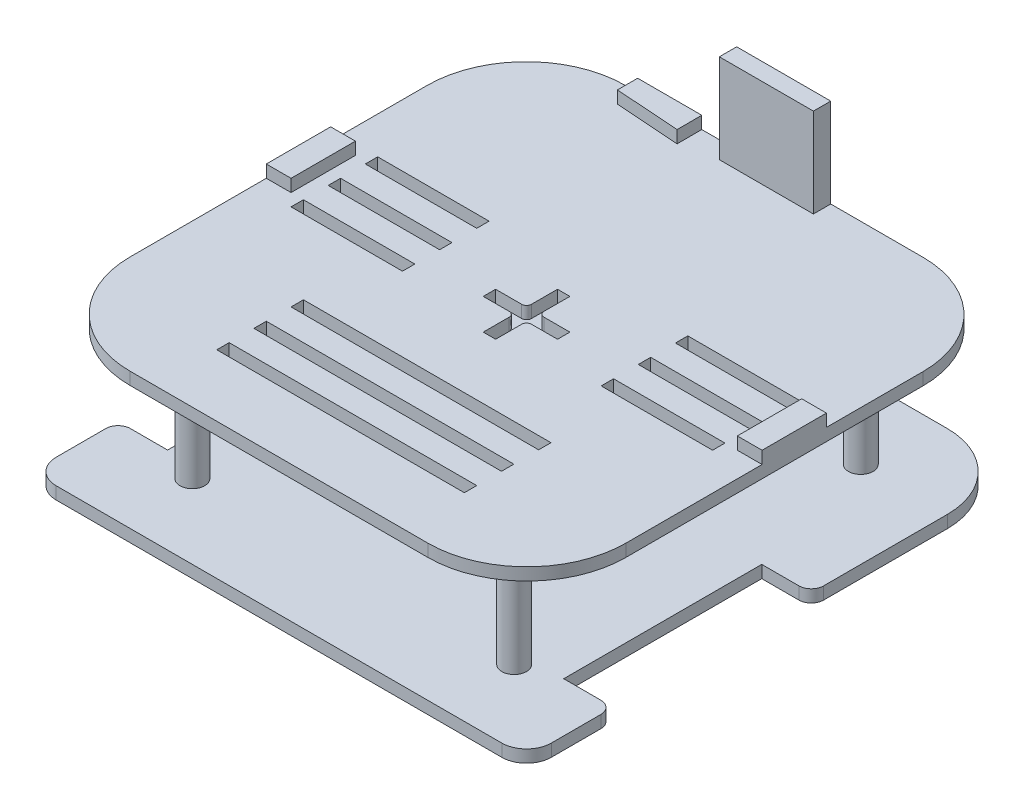
from build123d import *

# Parameters (mm, degrees)
SKETCH1_W                = 200
SKETCH1_H                = 200
BOSS_EXTRUDE1_DEPTH      = 5
FILLET1_R                = 10
FILLET3_R                = 30
SKETCH5_W                = 20
SKETCH5_H                = 80
CUT_EXTRUDE2_DEPTH       = 142.509716981
BOSS_EXTRUDE3_DEPTH      = 100
BOSS_EXTRUDE3_DEPTH_BACK = 100
SKETCH8_W                = 240
SKETCH8_H                = 5
SKETCH9_R                = 5
BOSS_EXTRUDE4_DEPTH      = 58
MIRROR6_COPY_1_SKETCH_R  = 5
MIRROR6_COPY_1_DEPTH     = 58
FILLET4_R                = 5
SKETCH11_W               = 12.5
SKETCH11_H               = 5
SKETCH11_W_2             = 5
SKETCH11_H_2             = 12.5
CUT_EXTRUDE4_DEPTH       = 5
FILLET6_R                = 2
SKETCH15_W               = 100
SKETCH15_H               = 5
SKETCH15_W_2             = 45
CUT_EXTRUDE6_DEPTH       = 5
SKETCH18_W               = 20
SKETCH18_H               = 200
CUT_EXTRUDE7_DEPTH       = 5
FILLET7_R                = 40
SKETCH22_W               = 6
SKETCH22_H               = 17
CUT_EXTRUDE10_DEPTH      = 5
SKETCH26_W               = 10
SKETCH26_H               = 26
BOSS_EXTRUDE6_DEPTH      = 5
SKETCH27_W               = 38
SKETCH27_H               = 7
BOSS_EXTRUDE7_DEPTH      = 36


with BuildPart() as part:
    # Sketch1 → Boss-Extrude1 (new body)
    with BuildSketch(Plane(origin=(0, 0, 0), x_dir=(1, 0, 0), z_dir=(0, 1, 0))):
        Rectangle(SKETCH1_W, SKETCH1_H)
    extrude(amount=BOSS_EXTRUDE1_DEPTH)

    # Fillet1
    fillet1_edges = [part.edges().sort_by_distance(p)[0] for p in [
        (100, 2.5, 100),
        (-100, 2.5, 100),
    ]]
    fillet(fillet1_edges, radius=FILLET1_R)

    # Fillet3
    fillet3_edges = [part.edges().sort_by_distance(p)[0] for p in [
        (-100, 2.5, -100),
        (100, 2.5, -100),
    ]]
    fillet(fillet3_edges, radius=FILLET3_R)

    # Sketch5 → Cut-Extrude2 (cut, through all)
    with BuildSketch(Plane(origin=(0, 5, 0), x_dir=(1, 0, 0), z_dir=(0, 1, 0))):
        with Locations((90, -25)):
            Rectangle(SKETCH5_W, SKETCH5_H)
    cut_extrude2 = extrude(amount=-CUT_EXTRUDE2_DEPTH, mode=Mode.SUBTRACT)

    # Mirror1: Cut-Extrude2 across plane
    add(cut_extrude2.mirror(Plane(origin=(0, 0, 0), x_dir=(0, 0, 1), z_dir=(1, 0, 0))), mode=Mode.SUBTRACT)

    # Sketch9 → Boss-Extrude4 (add)
    with BuildSketch(Plane(origin=(0, 0, 0), x_dir=(1, 0, 0), z_dir=(0, 1, 0))):
        with Locations(Location((-65, -70, 0), (0, 0, 90))):
            Circle(SKETCH9_R)
    boss_extrude4 = extrude(amount=BOSS_EXTRUDE4_DEPTH)

    # Mirror5: Boss-Extrude4 across plane
    add(boss_extrude4.mirror(Plane(origin=(0, 0, 0), x_dir=(0, 0, 1), z_dir=(1, 0, 0))))

    # Mirror6: Boss-Extrude4 across plane
    add(boss_extrude4.mirror(Plane.XY))

    # Mirror6 copy 1 sketch → Mirror6 copy 1 (add)
    with BuildSketch(Plane(origin=(0, 0, 0), x_dir=(-1, 0, 0), z_dir=(0, 1, 0))):
        with Locations(Location((-65, -70, 0), (0, 0, 90))):
            Circle(MIRROR6_COPY_1_SKETCH_R)
    extrude(amount=MIRROR6_COPY_1_DEPTH)

    # Fillet4
    fillet4_edges = [part.edges().sort_by_distance(p)[0] for p in [
        (100, 2.5, -15),
        (100, 2.5, 65),
        (-100, 2.5, 65),
        (-100, 2.5, -15),
    ]]
    fillet(fillet4_edges, radius=FILLET4_R)

    # Sketch22 → Cut-Extrude10 (cut)
    with BuildSketch(Plane(origin=(0, 5, 0), x_dir=(1, 0, 0), z_dir=(0, 1, 0))):
        with Locations((19.2, -24.5)):
            Rectangle(SKETCH22_W, SKETCH22_H)
    cut_extrude10 = extrude(amount=-CUT_EXTRUDE10_DEPTH, mode=Mode.SUBTRACT)

    # Mirror8: Cut-Extrude10 across plane
    add(cut_extrude10.mirror(Plane(origin=(0, 0, 0), x_dir=(0, 0, 1), z_dir=(1, 0, 0))), mode=Mode.SUBTRACT)


with BuildPart() as body_2:
    # Sketch8 → Boss-Extrude3 (new, two sides: drawn at the far end of the back side and taken through both)
    with BuildSketch(Plane.XY.offset(-BOSS_EXTRUDE3_DEPTH_BACK)):
        with Locations((-0.132111847, 57.5)):
            Rectangle(SKETCH8_W, SKETCH8_H)
    extrude(amount=BOSS_EXTRUDE3_DEPTH + BOSS_EXTRUDE3_DEPTH_BACK)

    # Sketch11 → Cut-Extrude4 (cut)
    with BuildSketch(Plane(origin=(0, 60, 0), x_dir=(1, 0, 0), z_dir=(0, 1, 0))):
        with Locations((8.75, 0)):
            Rectangle(SKETCH11_W, SKETCH11_H)
        with Locations((0, -8.75)):
            Rectangle(SKETCH11_W_2, SKETCH11_H_2)
        with Locations((-8.75, 0)):
            Rectangle(SKETCH11_W, SKETCH11_H)
        with Locations((0, 8.75)):
            Rectangle(SKETCH11_W_2, SKETCH11_H_2)
        Rectangle(SKETCH11_W_2, SKETCH11_H)
    extrude(amount=-CUT_EXTRUDE4_DEPTH, mode=Mode.SUBTRACT)

    # Fillet6
    fillet6_edges = [body_2.edges().sort_by_distance(p)[0] for p in [
        (2.5, 57.5, 2.5),
        (-2.5, 57.5, 2.5),
        (-2.5, 57.5, -2.5),
        (2.5, 57.5, -2.5),
    ]]
    fillet(fillet6_edges, radius=FILLET6_R)

    # Sketch15 → Cut-Extrude6 (cut)
    with BuildSketch(Plane(origin=(0, 60, 0), x_dir=(1, 0, 0), z_dir=(0, 1, 0))):
        with Locations((-0.132111847, -42.5)):
            Rectangle(SKETCH15_W, SKETCH15_H)
        with Locations((-0.132111847, -57.5)):
            Rectangle(SKETCH15_W, SKETCH15_H)
        with Locations((-0.132111847, -72.5)):
            Rectangle(SKETCH15_W, SKETCH15_H)
        with Locations((-62.632111847, -7.5)):
            Rectangle(SKETCH15_W_2, SKETCH15_H)
        with Locations((-62.632111847, 7.5)):
            Rectangle(SKETCH15_W_2, SKETCH15_H)
        with Locations((-62.632111847, 22.5)):
            Rectangle(SKETCH15_W_2, SKETCH15_H)
        with Locations((62.632111847, -7.5)):
            Rectangle(SKETCH15_W_2, SKETCH15_H)
        with Locations((62.632111847, 7.5)):
            Rectangle(SKETCH15_W_2, SKETCH15_H)
        with Locations((62.632111847, 22.5)):
            Rectangle(SKETCH15_W_2, SKETCH15_H)
    extrude(amount=-CUT_EXTRUDE6_DEPTH, mode=Mode.SUBTRACT)

    # Sketch18 → Cut-Extrude7 (cut)
    with BuildSketch(Plane(origin=(0, 60, 0), x_dir=(1, 0, 0), z_dir=(0, 1, 0))):
        with Locations((-110.132111847, 0)):
            Rectangle(SKETCH18_W, SKETCH18_H)
    cut_extrude7 = extrude(amount=-CUT_EXTRUDE7_DEPTH, mode=Mode.SUBTRACT)

    # Mirror7: Cut-Extrude7 across plane
    add(cut_extrude7.mirror(Plane(origin=(0, 0, 0), x_dir=(0, 0, 1), z_dir=(1, 0, 0))), mode=Mode.SUBTRACT)

    # Fillet7
    fillet7_edges = [body_2.edges().sort_by_distance(p)[0] for p in [
        (-100.132111847, 57.5, -100),
        (-100.132111847, 57.5, 100),
        (100.132111847, 57.5, 100),
        (100.132111847, 57.5, -100),
    ]]
    fillet(fillet7_edges, radius=FILLET7_R)

    # Sketch26 → Boss-Extrude6 (add)
    with BuildSketch(Plane(origin=(0, 60, 0), x_dir=(1, 0, 0), z_dir=(0, 1, 0))):
        with Locations((95.132111847, 8)):
            Rectangle(SKETCH26_W, SKETCH26_H)
        with Locations((-95.132111847, 8)):
            Rectangle(SKETCH26_W, SKETCH26_H)
        Polygon((-55.132111847, 91.834478025), (-55.132111847, 100), (-29.242880108, 100), (-29.19690261, 90.000105697), align=None)
    extrude(amount=BOSS_EXTRUDE6_DEPTH)

    # Sketch27 → Boss-Extrude7 (add)
    with BuildSketch(Plane(origin=(0, 60, 0), x_dir=(1, 0, 0), z_dir=(0, 1, 0))):
        with Locations((3.867888153, 96.5)):
            Rectangle(SKETCH27_W, SKETCH27_H)
    extrude(amount=BOSS_EXTRUDE7_DEPTH)


solid = Compound([part.part, body_2.part])
